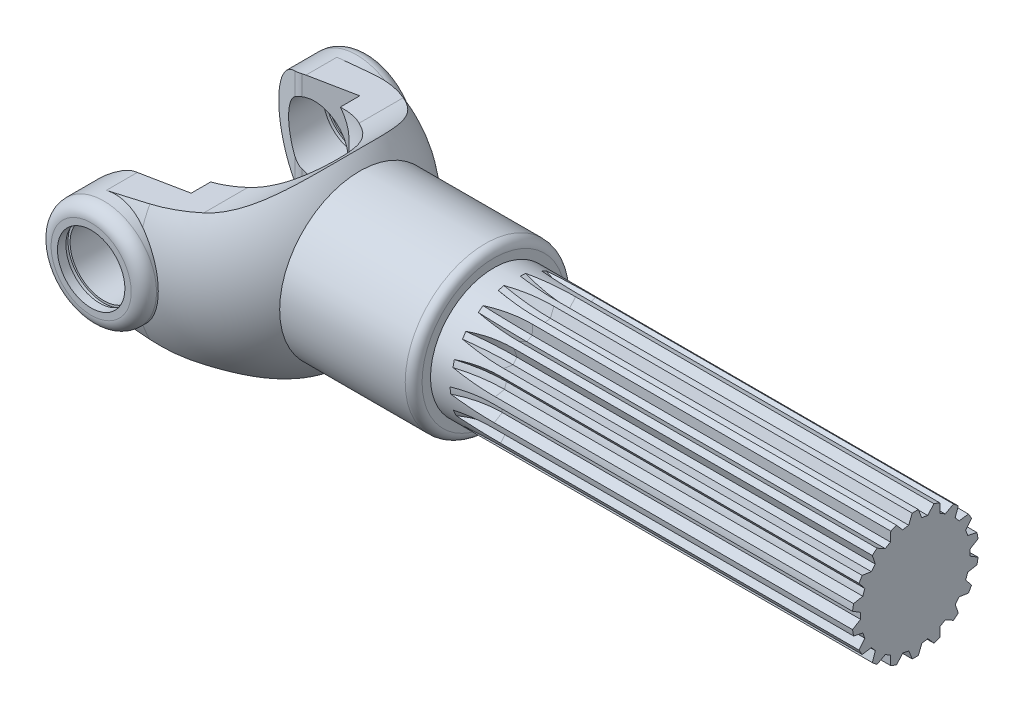
from build123d import *
from build123d.topology import SkipClean

# Parameters (mm, degrees)
CUT_EXTRUDE1_DEPTH      = 168.947164311
CUT_EXTRUDE1_DEPTH_BACK = 168.947164311
CUT_EXTRUDE2_DEPTH      = 167.629079126
CUT_EXTRUDE2_DEPTH_BACK = 167.629079126
FILLET1_R               = 5
CUT_EXTRUDE3_DEPTH      = 168.19524518
CUT_EXTRUDE3_DEPTH_BACK = 168.19524518
SKETCH17_R              = 8
SKETCH19_W              = 0.5
SKETCH19_H              = 1
FILLET2_R               = 2
CIRPATTERN1_COUNT       = 18


with BuildPart() as part:
    # Sketch1 → Revolve1 (revolve)
    with BuildSketch(Plane.XY, mode=Mode.PRIVATE) as revolve1_sk:
        with BuildLine():
            Line((-12.5, 0), (162.5, 0))
            Line((162.5, 0), (162.5, 15))
            Line((162.5, 15), (62.5, 15))
            Line((62.5, 15), (62.5, 19))
            Line((62.5, 19), (30.716373532, 19))
            ThreePointArc((30.716373532, 19), (20.345232579, 27.110883423), (7.5, 30))
            Line((7.5, 30), (-12.5, 30))
            Line((-12.5, 30), (-12.5, 0))
        make_face()
    revolve(revolve1_sk.sketch.rotate(Axis((-12.5, 0, 0), (1, 0, 0)), 90), axis=Axis((-12.5, 0, 0), (1, 0, 0)))

    # Sketch2 → Cut-Extrude1 (cut, two sides: drawn at the far end of the back side and taken through both)
    with BuildSketch(Plane.XY.offset(-CUT_EXTRUDE1_DEPTH_BACK)):
        with BuildLine():
            Line((-2.053003812, 12.330254472), (17.374844902, 15.56501719))
            ThreePointArc((17.374844902, 15.56501719), (23.40985388, 17.59763256), (28.5, 21.424285286))
            Line((28.5, 21.424285286), (28.5, 52.597216619))
            Line((28.5, 52.597216619), (-34.918499951, 53.310449368))
            Line((-34.918499951, 53.310449368), (-34.918499951, -53.310449368))
            Line((-34.918499951, -53.310449368), (28.5, -52.597216619))
            Line((28.5, -52.597216619), (28.5, -21.424285286))
            ThreePointArc((28.5, -21.424285286), (23.40985388, -17.59763256), (17.374844902, -15.56501719))
            Line((17.374844902, -15.56501719), (-2.053003812, -12.330254472))
            ThreePointArc((-2.053003812, -12.330254472), (-12.5, 0), (-2.053003812, 12.330254472))
        make_face()
    extrude(amount=CUT_EXTRUDE1_DEPTH + CUT_EXTRUDE1_DEPTH_BACK, mode=Mode.SUBTRACT)

    # Sketch11 → Cut-Extrude2 (cut, two sides: drawn at the far end of the back side and taken through both)
    with BuildSketch(Plane(origin=(0, 0, 0), x_dir=(1, 0, 0), z_dir=(0, 1, 0)).offset(-CUT_EXTRUDE2_DEPTH_BACK)):
        Polygon((0, 18), (0, -18), (-12.5, -24), (-12.5, 24), align=None)
    extrude(amount=CUT_EXTRUDE2_DEPTH + CUT_EXTRUDE2_DEPTH_BACK, mode=Mode.SUBTRACT)

    # Sketch12 → Cut-Revolve2 (revolve, cut)
    with BuildSketch(Plane(origin=(0, 0, 0), x_dir=(0, 0, -1), z_dir=(1, 0, 0))):
        with BuildLine():
            Line((-20, 0), (20, 0))
            Line((20, 0), (20, 18))
            Line((20, 18), (8.005623024, 18))
            ThreePointArc((8.005623024, 18), (0, 19.7), (-8.005623024, 18))
            Line((-8.005623024, 18), (-20, 18))
            Line((-20, 18), (-20, 0))
        make_face()
    revolve(axis=Axis((0, 0, 20), (0, 0, -1)), mode=Mode.SUBTRACT)

    # Fillet1
    fillet1_edges = [part.edges().sort_by_distance(p)[0] for p in [
        (-4.166666667, 0, 20),
        (-4.166666667, 0, -20),
    ]]
    fillet(fillet1_edges, radius=FILLET1_R)

    # Sketch14 → Revolve2 (revolve)
    with SkipClean():  # the faces are left unmerged after this step: merging them gives an invalid solid
        with BuildSketch(Plane(origin=(0, 0, 0), x_dir=(1, 0, 0), z_dir=(0, 1, 0)), mode=Mode.PRIVATE) as revolve2_sk:
            with BuildLine():
                Line((-12.5, 24), (0, 24))
                Line((0, 24), (0, 33))
                Line((0, 33), (-9.5, 33))
                ThreePointArc((-9.5, 33), (-11.621320344, 32.121320344), (-12.5, 30))
                Line((-12.5, 30), (-12.5, 24))
            make_face()
        revolve2 = revolve(revolve2_sk.sketch.rotate(Axis((0, 0, 0), (0, 0, -1)), 180), axis=Axis((0, 0, 0), (0, 0, -1)))

    # Mirror1: Revolve2 across plane
    with SkipClean():  # the faces are left unmerged after this step: merging them gives an invalid solid
        add(revolve2.mirror(Plane.XY))

    # Sketch17 → Cut-Extrude3 (cut, two sides: drawn at the far end of the back side and taken through both)
    with SkipClean():  # the faces are left unmerged after this step: merging them gives an invalid solid
        with BuildSketch(Plane.XY.offset(-CUT_EXTRUDE3_DEPTH_BACK)):
            Circle(SKETCH17_R)
        extrude(amount=CUT_EXTRUDE3_DEPTH + CUT_EXTRUDE3_DEPTH_BACK, mode=Mode.SUBTRACT)

    # Sketch19 → Cut-Revolve4 (revolve, cut)
    with SkipClean():  # the faces are left unmerged after this step: merging them gives an invalid solid
        with BuildSketch(Plane(origin=(0, 0, 0), x_dir=(1, 0, 0), z_dir=(0, 1, 0))):
            with Locations((8.25, 30.5)):
                Rectangle(SKETCH19_W, SKETCH19_H)
        cut_revolve4 = revolve(axis=Axis((0, 0, 0), (0, 0, -1)), mode=Mode.SUBTRACT)

    # Mirror2: Cut-Revolve4 across plane
    with SkipClean():  # the faces are left unmerged after this step: merging them gives an invalid solid
        add(cut_revolve4.mirror(Plane.XY), mode=Mode.SUBTRACT)

    # Sketch20 → Cut-Revolve5 (revolve, cut)
    with SkipClean():  # the faces are left unmerged after this step: merging them gives an invalid solid
        with BuildSketch(Plane.XY):
            with BuildLine():
                Line((6.25, 10.825317547), (19.240381057, 3.325317547))
                ThreePointArc((19.240381057, 3.325317547), (23.735777108, 10.589555081), (25.501467019, 18.947788851))
                Line((25.501467019, 18.947788851), (14.58, 25.253300774))
                Line((14.58, 25.253300774), (6.25, 10.825317547))
            make_face()
        cut_revolve5 = revolve(axis=Axis((0, 0, 0), (0.500000000000001, 0.866025403784438, 0)), mode=Mode.SUBTRACT)

    # Mirror3: Cut-Revolve5 across plane
    add(cut_revolve5.mirror(Plane.ZX), mode=Mode.SUBTRACT)

    # Fillet2
    fillet2_edges = [part.edges().sort_by_distance(p)[0] for p in [
        (62.5, 0, -19),
    ]]
    fillet(fillet2_edges, radius=FILLET2_R)

    # Cut-Sweep1: sweep along a path in Sketch24
    with BuildLine(Plane.XY.offset(-2.602180064)) as cut_sweep1_path:
        Line((162.5, 15), (77.5, 15))
        ThreePointArc((77.5, 15), (71.854143467, 15.645856533), (66.5, 17.550055679))
    # Sketch21 → Cut-Sweep1 (sweep, cut)
    with BuildSketch(Plane(origin=(162.5, 0, 0), x_dir=(0, 0, -1), z_dir=(1, 0, 0))):
        with BuildLine():
            Line((0.732746547, 14.98209206), (1.539251588, 12.908551605))
            ThreePointArc((1.539251588, 12.908551605), (2.249162515, 12.803955169), (2.95222063, 12.660347284))
            Line((2.95222063, 12.660347284), (4.435620751, 14.329175432))
            ThreePointArc((4.435620751, 14.329175432), (2.604722665, 14.772116295), (0.732746547, 14.98209206))
        make_face()
    cut_sweep1 = sweep(path=cut_sweep1_path.line, mode=Mode.SUBTRACT)

    # CirPattern1: Cut-Sweep1 ×18 about axis
    cirpattern1_axis = Axis((0, 0, 0), (1, 0, 0))
    for i in range(1, CIRPATTERN1_COUNT):
        add(cut_sweep1.rotate(cirpattern1_axis, i * 360 / CIRPATTERN1_COUNT), mode=Mode.SUBTRACT)


solid = part.part
